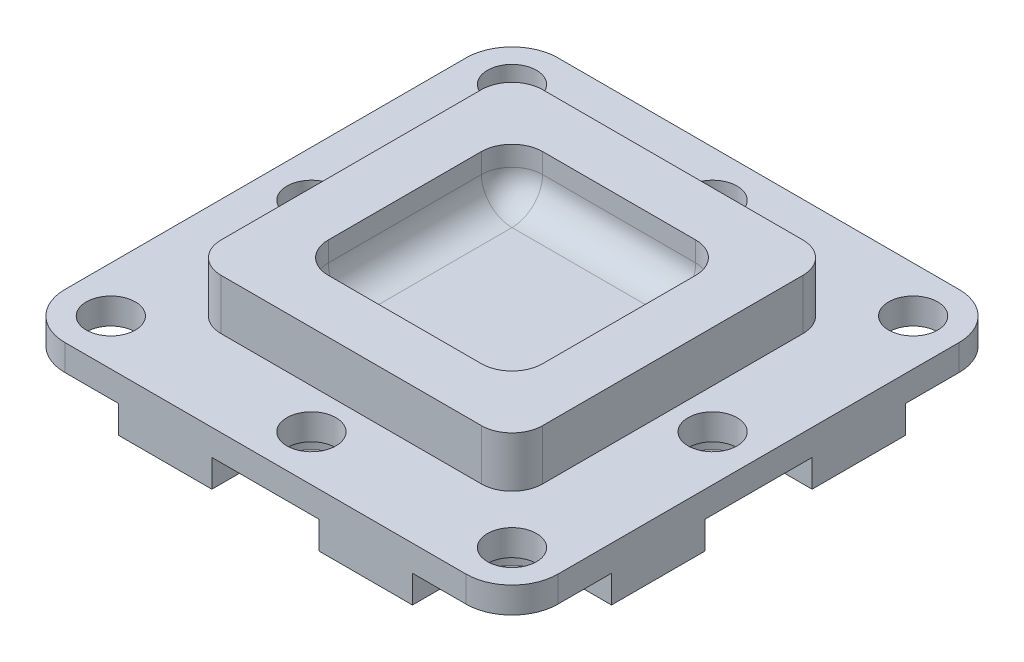
from build123d import *

# Parameters (mm, degrees)
SKETCH1_W           = 32.2
SKETCH1_H           = 32.2
BOSS_EXTRUDE1_DEPTH = 3.5
SKETCH2_W           = 21
SKETCH2_H           = 21
BOSS_EXTRUDE3_DEPTH = 3.3
FILLET1_R           = 3
FILLET2_R           = 2
SKETCH10_W          = 14
SKETCH10_H          = 14
CUT_EXTRUDE2_DEPTH  = 3.3
FILLET3_R           = 2
SKETCH9_R           = 1.6
CUT_EXTRUDE1_DEPTH  = 7
SKETCH11_R          = 1.6
CUT_EXTRUDE3_DEPTH  = 24.762575618
CUT_EXTRUDE5_DEPTH  = 1.8
CUT_EXTRUDE6_DEPTH  = 0.5


with BuildPart() as part:
    # Sketch1 → Boss-Extrude1 (new body)
    with BuildSketch(Plane(origin=(0, 0, 0), x_dir=(1, 0, 0), z_dir=(0, 1, 0))):
        Rectangle(SKETCH1_W, SKETCH1_H)
    extrude(amount=BOSS_EXTRUDE1_DEPTH)

    # Sketch2 → Boss-Extrude3 (add)
    with BuildSketch(Plane(origin=(0, 3.5, 0), x_dir=(1, 0, 0), z_dir=(0, 1, 0))):
        Rectangle(SKETCH2_W, SKETCH2_H)
    extrude(amount=BOSS_EXTRUDE3_DEPTH)

    # Fillet1
    fillet1_edges = [part.edges().sort_by_distance(p)[0] for p in [
        (16.1, 1.75, 16.1),
        (-16.1, 1.75, 16.1),
        (-16.1, 1.75, -16.1),
        (16.1, 1.75, -16.1),
    ]]
    fillet(fillet1_edges, radius=FILLET1_R)

    # Fillet2
    fillet2_edges = [part.edges().sort_by_distance(p)[0] for p in [
        (10.5, 5.15, 10.5),
        (10.5, 5.15, -10.5),
        (-10.5, 5.15, -10.5),
        (-10.5, 5.15, 10.5),
    ]]
    fillet(fillet2_edges, radius=FILLET2_R)

    # Sketch10 → Cut-Extrude2 (cut)
    with BuildSketch(Plane(origin=(0, 6.8, 0), x_dir=(1, 0, 0), z_dir=(0, 1, 0))):
        Rectangle(SKETCH10_W, SKETCH10_H)
    extrude(amount=-CUT_EXTRUDE2_DEPTH, mode=Mode.SUBTRACT)

    # Fillet3
    fillet3_edges = [part.edges().sort_by_distance(p)[0] for p in [
        (0, 3.5, -7),
        (-7, 5.15, -7),
        (-7, 3.5, 0),
        (-7, 5.15, 7),
        (0, 3.5, 7),
        (7, 5.15, 7),
        (7, 3.5, 0),
        (7, 5.15, -7),
    ]]
    fillet(fillet3_edges, radius=FILLET3_R)

    # Sketch9 → Cut-Extrude1 (cut)
    with BuildSketch(Plane(origin=(0, 3.5, 0), x_dir=(1, 0, 0), z_dir=(0, 1, 0))):
        with Locations(Location((0, 13.1, 0), (0, 0, 270))):
            Circle(SKETCH9_R)
        with Locations(Location((13.1, 0, 0), (0, 0, 270))):
            Circle(SKETCH9_R)
        with Locations(Location((0, -13.1, 0), (0, 0, 270))):
            Circle(SKETCH9_R)
        with Locations(Location((-13.1, 0, 0), (0, 0, 270))):
            Circle(SKETCH9_R)
    extrude(amount=-CUT_EXTRUDE1_DEPTH, mode=Mode.SUBTRACT)

    # Sketch11 → Cut-Extrude3 (cut, through all)
    with BuildSketch(Plane.XZ):
        with Locations(Location((-13.1, 13.1, 0), (0, 0, 270))):
            Circle(SKETCH11_R)
        with Locations(Location((13.1, 13.1, 0), (0, 0, 270))):
            Circle(SKETCH11_R)
        with Locations(Location((13.1, -13.1, 0), (0, 0, 270))):
            Circle(SKETCH11_R)
        with Locations(Location((-13.1, -13.1, 0), (0, 0, 270))):
            Circle(SKETCH11_R)
    extrude(amount=-CUT_EXTRUDE3_DEPTH, mode=Mode.SUBTRACT)

    # Sketch12 → Cut-Extrude5 (cut)
    with BuildSketch(Plane.XZ):
        with BuildLine():
            Line((-13.1, 9.6), (-16.1, 9.6))
            Line((-16.1, 9.6), (-16.1, 16.1))
            Line((-16.1, 16.1), (-9.6, 16.1))
            Line((-9.6, 16.1), (-9.6, 13.1))
            ThreePointArc((-9.6, 13.1), (-10.625126266, 10.625126266), (-13.1, 9.6))
        make_face()
        with BuildLine():
            Line((-3.5, 13.1), (-3.5, 16.1))
            Line((-3.5, 16.1), (3.5, 16.1))
            Line((3.5, 16.1), (3.5, 13.1))
            ThreePointArc((3.5, 13.1), (0, 9.6), (-3.5, 13.1))
        make_face()
        with BuildLine():
            Line((13.1, 3.5), (16.1, 3.5))
            Line((16.1, 3.5), (16.1, -3.5))
            Line((16.1, -3.5), (13.1, -3.5))
            ThreePointArc((13.1, -3.5), (9.6, 0), (13.1, 3.5))
        make_face()
        with BuildLine():
            Line((3.5, -13.1), (3.5, -16.1))
            Line((3.5, -16.1), (-3.5, -16.1))
            Line((-3.5, -16.1), (-3.5, -13.1))
            ThreePointArc((-3.5, -13.1), (0, -9.6), (3.5, -13.1))
        make_face()
        with BuildLine():
            Line((-13.1, -3.5), (-16.1, -3.5))
            Line((-16.1, -3.5), (-16.1, 3.5))
            Line((-16.1, 3.5), (-13.1, 3.5))
            ThreePointArc((-13.1, 3.5), (-9.6, 0), (-13.1, -3.5))
        make_face()
        with BuildLine():
            Line((9.6, 13.1), (9.6, 16.1))
            Line((9.6, 16.1), (16.1, 16.1))
            Line((16.1, 16.1), (16.1, 9.6))
            Line((16.1, 9.6), (13.1, 9.6))
            ThreePointArc((13.1, 9.6), (10.625126266, 10.625126266), (9.6, 13.1))
        make_face()
        with BuildLine():
            Line((13.1, -9.6), (16.1, -9.6))
            Line((16.1, -9.6), (16.1, -16.1))
            Line((16.1, -16.1), (9.6, -16.1))
            Line((9.6, -16.1), (9.6, -13.1))
            ThreePointArc((9.6, -13.1), (10.625126266, -10.625126266), (13.1, -9.6))
        make_face()
        with BuildLine():
            Line((-9.6, -13.1), (-9.6, -16.1))
            Line((-9.6, -16.1), (-16.1, -16.1))
            Line((-16.1, -16.1), (-16.1, -9.6))
            Line((-16.1, -9.6), (-13.1, -9.6))
            ThreePointArc((-13.1, -9.6), (-10.625126266, -10.625126266), (-9.6, -13.1))
        make_face()
    extrude(amount=-CUT_EXTRUDE5_DEPTH, mode=Mode.SUBTRACT)

    # Sketch13 → Cut-Extrude6 (cut)
    # profile 1 of 6: a face of its own
    with BuildSketch(Plane(origin=(0, 0, 0), x_dir=(-1, 0, 0), z_dir=(0, -1, 0))):
        with BuildLine():
            add(Edge.make_bspline(
                [(-3.374888958, -0.575719771), (-3.353910365, -0.592843), (-3.312166011, -0.626915741), (-3.245070547, -0.671708656), (-3.175802228, -0.712439804), (-3.127253594, -0.734927656), (-3.102973374, -0.746174317)],
                knots=[0, 0, 0, 0, 1.00866874, 2.00710438, 3.003309844, 4, 4, 4, 4], degree=3))
            Line((-3.102973374, -0.746174317), (-3.22756753, -1.021336654))
            add(Edge.make_bspline(
                [(-3.22756753, -1.021336654), (-3.252748596, -1.011665292), (-3.304075792, -0.991951912), (-3.351797169, -0.964635024), (-3.376106491, -0.950719771)],
                knots=[0, 0, 0, 0, 0.981197824, 2, 2, 2, 2], degree=3))
            add(Edge.make_bspline(
                [(-3.376106491, -0.950719771), (-3.378546656, -0.949103953), (-3.385523996, -0.944483728), (-3.398956827, -0.935063), (-3.4183981, -0.920800488), (-3.443942113, -0.901692247), (-3.47556492, -0.877879475), (-3.512829919, -0.848751255), (-3.556805929, -0.815703153), (-3.587979338, -0.791793214), (-3.60459675, -0.779047693)],
                knots=[0, 0, 0, 0, 0.245733965, 0.702644866, 1.377434016, 2.270258751, 3.381183773, 4.701231263, 6.241546137, 8, 8, 8, 8], degree=3))
            add(Edge.make_bspline(
                [(-3.60459675, -0.779047693), (-3.618300093, -0.786018401), (-3.64569084, -0.79995171), (-3.688570898, -0.817168408), (-3.732496042, -0.832426458), (-3.778079583, -0.844577823), (-3.825295009, -0.853789145), (-3.873909342, -0.860734788), (-3.923922732, -0.864891407), (-3.957673379, -0.865290731), (-3.97472662, -0.865492498)],
                knots=[0, 0, 0, 0, 0.96057198, 1.920026713, 2.885388124, 3.865852884, 4.865850518, 5.890708888, 6.934235263, 8, 8, 8, 8], degree=3))
            add(Edge.make_bspline(
                [(-3.97472662, -0.865492498), (-4.003595932, -0.864804682), (-4.060133704, -0.863457661), (-4.142609937, -0.850183912), (-4.221092935, -0.830389621), (-4.295117072, -0.800970455), (-4.365354173, -0.764293287), (-4.430511274, -0.718074343), (-4.491943721, -0.664589017), (-4.548617474, -0.602861591), (-4.60008491, -0.533317659), (-4.644143378, -0.455568933), (-4.682167346, -0.370891255), (-4.712228357, -0.278518544), (-4.736279231, -0.179214229), (-4.752840652, -0.072509427), (-4.763842385, 0.041473673), (-4.76481152, 0.120004689), (-4.765311036, 0.160481528)],
                knots=[0, 0, 0, 0, 0.947648696, 1.855878837, 2.737616271, 3.60168255, 4.466468547, 5.334434689, 6.219492212, 7.137875445, 8.081848884, 9.055322791, 10.067899029, 11.126141109, 12.241766859, 13.421002704, 14.670720672, 16, 16, 16, 16], degree=3))
            add(Edge.make_bspline(
                [(-4.765311036, 0.160481528), (-4.764807119, 0.200957844), (-4.763827769, 0.279622593), (-4.752843981, 0.393879364), (-4.736281731, 0.500845718), (-4.712368629, 0.600389017), (-4.68160542, 0.692557887), (-4.643953334, 0.777401308), (-4.599104008, 0.854749217), (-4.547422085, 0.924268421), (-4.490283797, 0.985933742), (-4.428615913, 1.039530788), (-4.362832018, 1.08505113), (-4.292531173, 1.122223639), (-4.217851179, 1.151077332), (-4.138946882, 1.171893923), (-4.055743644, 1.184206467), (-3.998848194, 1.185696361), (-3.969856491, 1.186455554)],
                knots=[0, 0, 0, 0, 1.325551311, 2.576177175, 3.756481842, 4.868978776, 5.925657186, 6.935393612, 7.904517475, 8.848479123, 9.767294862, 10.653212949, 11.519856, 12.382216669, 13.252116938, 14.136792688, 15.05058218, 16, 16, 16, 16], degree=3))
            add(Edge.make_bspline(
                [(-3.969856491, 1.186455554), (-3.941132787, 1.185709096), (-3.884904679, 1.184247866), (-3.802538998, 1.171784149), (-3.724398718, 1.151154272), (-3.650402027, 1.122222849), (-3.58085668, 1.084930623), (-3.515545363, 1.039532342), (-3.454292064, 0.985916571), (-3.397566798, 0.924249691), (-3.346252099, 0.854746102), (-3.302004123, 0.777379279), (-3.264194045, 0.69298461), (-3.233245276, 0.601144024), (-3.21017311, 0.501843612), (-3.193267001, 0.395388416), (-3.182400518, 0.281647971), (-3.181406805, 0.203256142), (-3.180895452, 0.162916593)],
                knots=[0, 0, 0, 0, 0.945533866, 1.850930545, 2.735974148, 3.602169806, 4.4612212, 5.328779171, 6.216017803, 7.136664272, 8.082964012, 9.054975088, 10.065981232, 11.124021059, 12.241357431, 13.419100612, 14.671898348, 16, 16, 16, 16], degree=3))
            add(Edge.make_bspline(
                [(-3.180895452, 0.162916593), (-3.181353071, 0.123935416), (-3.182234672, 0.048838527), (-3.191400425, -0.059574831), (-3.205609691, -0.159565044), (-3.226102879, -0.252090127), (-3.252426213, -0.338916065), (-3.286743221, -0.421129488), (-3.326473103, -0.500817974), (-3.358716895, -0.550700766), (-3.374888958, -0.575719771)],
                knots=[0, 0, 0, 0, 1.205362501, 2.322120058, 3.362359562, 4.326735612, 5.250511105, 6.164254531, 7.079271134, 8, 8, 8, 8], degree=3))
        make_face()
        with BuildLine():
            add(Edge.make_bspline(
                [(-3.648022075, -0.345606135), (-3.63545867, -0.330470406), (-3.610003545, -0.29980341), (-3.578547091, -0.247780512), (-3.552227592, -0.190881694), (-3.530161085, -0.129260367), (-3.513306182, -0.062509006), (-3.501280578, 0.009151018), (-3.493864143, 0.085785356), (-3.493019388, 0.138548524), (-3.492583763, 0.165757502)],
                knots=[0, 0, 0, 0, 0.863345217, 1.749252022, 2.661353163, 3.614576314, 4.620864843, 5.682111508, 6.804708329, 8, 8, 8, 8], degree=3))
            add(Edge.make_bspline(
                [(-3.492583763, 0.165757502), (-3.4929016, 0.193910779), (-3.493515278, 0.248269092), (-3.500232534, 0.32699693), (-3.510541327, 0.40009642), (-3.524996586, 0.467566517), (-3.543575863, 0.52946165), (-3.566713372, 0.585591085), (-3.593785388, 0.636476595), (-3.625732819, 0.681238774), (-3.660707181, 0.720527178), (-3.697779743, 0.75521533), (-3.737738562, 0.783977599), (-3.779941228, 0.807970143), (-3.824741052, 0.826192979), (-3.87189054, 0.839091521), (-3.921247493, 0.847688952), (-3.955073739, 0.848420733), (-3.972291555, 0.848793216)],
                knots=[0, 0, 0, 0, 1.436691862, 2.773962903, 4.029794328, 5.202699272, 6.292689818, 7.323690881, 8.296929065, 9.22807889, 10.123225381, 10.978380823, 11.814021444, 12.630264847, 13.45093584, 14.275201199, 15.1220643, 16, 16, 16, 16], degree=3))
            add(Edge.make_bspline(
                [(-3.972291555, 0.848793216), (-3.989510866, 0.848425707), (-4.023340048, 0.847703696), (-4.072804565, 0.83901297), (-4.12003303, 0.826355737), (-4.164919664, 0.807818459), (-4.207092095, 0.783658806), (-4.247231154, 0.754688854), (-4.284680927, 0.72026414), (-4.319672166, 0.680828005), (-4.351536357, 0.635961862), (-4.379204186, 0.58531599), (-4.402161116, 0.528851976), (-4.421286771, 0.466956453), (-4.435586563, 0.399402758), (-4.446047458, 0.326331405), (-4.452653493, 0.247724127), (-4.453293066, 0.193368495), (-4.453622724, 0.165351657)],
                knots=[0, 0, 0, 0, 0.876848581, 1.722663039, 2.552553991, 3.365829814, 4.19045996, 5.025065834, 5.884242765, 6.778280825, 7.708277638, 8.683608006, 9.713332414, 10.810589915, 11.982042488, 13.229493461, 14.571981773, 16, 16, 16, 16], degree=3))
            add(Edge.make_bspline(
                [(-4.453622724, 0.165351657), (-4.453249878, 0.136797574), (-4.452529776, 0.081649223), (-4.446545806, 0.00165222), (-4.435930516, -0.072442452), (-4.422104171, -0.141093249), (-4.403388196, -0.203807382), (-4.380761439, -0.260961877), (-4.353977952, -0.312480964), (-4.323085195, -0.35817187), (-4.288763382, -0.397776427), (-4.252964471, -0.432826788), (-4.214752501, -0.462267066), (-4.174175026, -0.485778475), (-4.13201531, -0.504890929), (-4.087682979, -0.518249047), (-4.041155566, -0.526079702), (-4.009523827, -0.527239039), (-3.993395452, -0.527830161)],
                knots=[0, 0, 0, 0, 1.469371971, 2.83789331, 4.124714215, 5.319424688, 6.438363687, 7.488110163, 8.478364614, 9.42066665, 10.319263503, 11.171036346, 11.995366908, 12.794166486, 13.579503905, 14.372365502, 15.170102543, 16, 16, 16, 16], degree=3))
            add(Edge.make_bspline(
                [(-3.993395452, -0.527830161), (-3.981329556, -0.52758852), (-3.957195486, -0.527105192), (-3.921762632, -0.521040296), (-3.886995244, -0.512270787), (-3.864929209, -0.503463317), (-3.853785062, -0.499015226)],
                knots=[0, 0, 0, 0, 1.00771838, 2.015627189, 2.9978198, 4, 4, 4, 4], degree=3))
            add(Edge.make_bspline(
                [(-3.853785062, -0.499015226), (-3.871340209, -0.485657725), (-3.905474244, -0.459685547), (-3.958445791, -0.425418298), (-4.01070884, -0.395557034), (-4.046562527, -0.379429399), (-4.064012335, -0.371580161)],
                knots=[0, 0, 0, 0, 1.073447796, 2.087200056, 3.069049988, 4, 4, 4, 4], degree=3))
            Line((-4.064012335, -0.371580161), (-3.968638958, -0.138219771))
            add(Edge.make_bspline(
                [(-3.968638958, -0.138219771), (-3.940635066, -0.1506716), (-3.883966153, -0.175869227), (-3.802813042, -0.224211253), (-3.72301942, -0.280077816), (-3.673344133, -0.323481193), (-3.648022075, -0.345606135)],
                knots=[0, 0, 0, 0, 0.957793148, 1.938198301, 2.94899324, 4, 4, 4, 4], degree=3))
        make_face(mode=Mode.SUBTRACT)
    # profile 2 of 6: a face of its own
    with BuildSketch(Plane(origin=(0, 0, 0), x_dir=(-1, 0, 0), z_dir=(0, -1, 0))):
        with BuildLine():
            Line((-1.856220127, -0.112245745), (-1.544531815, -0.242115875))
            add(Edge.make_bspline(
                [(-1.544531815, -0.242115875), (-1.550969068, -0.268316149), (-1.563512372, -0.319368677), (-1.587242575, -0.392337089), (-1.613354952, -0.460040661), (-1.643228978, -0.522100432), (-1.675840425, -0.579060873), (-1.712065109, -0.630361473), (-1.751221494, -0.676264894), (-1.793532293, -0.716663879), (-1.838928886, -0.751423977), (-1.886136655, -0.782398753), (-1.936374643, -0.807791472), (-1.988939383, -0.829231716), (-2.04424413, -0.845168974), (-2.10186869, -0.85716242), (-2.162060402, -0.864025629), (-2.203064796, -0.864998041), (-2.223914932, -0.865492498)],
                knots=[0, 0, 0, 0, 1.282586353, 2.499182829, 3.646034602, 4.730797578, 5.771318175, 6.763713287, 7.712684321, 8.6363956, 9.539720391, 10.428356747, 11.317388874, 12.212151588, 13.124116906, 14.050177375, 15.008543639, 16, 16, 16, 16], degree=3))
            add(Edge.make_bspline(
                [(-2.223914932, -0.865492498), (-2.250075506, -0.864904344), (-2.301323451, -0.863752165), (-2.376104051, -0.851354996), (-2.447264235, -0.832519657), (-2.51467573, -0.805471993), (-2.578418473, -0.77089932), (-2.637819078, -0.728075985), (-2.694263606, -0.67859623), (-2.727082211, -0.640016603), (-2.743801296, -0.620362628)],
                knots=[0, 0, 0, 0, 1.053414494, 2.063614103, 3.046293227, 4.01520277, 4.983805463, 5.961130836, 6.961320097, 8, 8, 8, 8], degree=3))
            add(Edge.make_bspline(
                [(-2.743801296, -0.620362628), (-2.762178929, -0.596097329), (-2.79920237, -0.547212642), (-2.845683245, -0.466601878), (-2.885216121, -0.379999161), (-2.91757183, -0.287325996), (-2.9427914, -0.188479712), (-2.960423154, -0.083413185), (-2.97101156, 0.027822765), (-2.972395445, 0.104045521), (-2.973103244, 0.143030229)],
                knots=[0, 0, 0, 0, 0.898140554, 1.809387162, 2.740718204, 3.705966939, 4.703925369, 5.74945803, 6.848943185, 8, 8, 8, 8], degree=3))
            add(Edge.make_bspline(
                [(-2.973103244, 0.143030229), (-2.972456619, 0.1841841), (-2.971197101, 0.264344935), (-2.959857055, 0.381051491), (-2.942569641, 0.491077997), (-2.916794823, 0.594015502), (-2.884506187, 0.690455082), (-2.84461367, 0.779795352), (-2.798294454, 0.862970675), (-2.760503268, 0.912645784), (-2.741772075, 0.937267242)],
                knots=[0, 0, 0, 0, 1.171098873, 2.281104103, 3.334483992, 4.338438261, 5.297974877, 6.225356982, 7.120398547, 8, 8, 8, 8], degree=3))
            add(Edge.make_bspline(
                [(-2.741772075, 0.937267242), (-2.724765077, 0.957169808), (-2.691247931, 0.996393496), (-2.633959157, 1.047185417), (-2.572413026, 1.090360359), (-2.50663181, 1.125709669), (-2.436321162, 1.153203208), (-2.361825198, 1.172603078), (-2.282845652, 1.184049779), (-2.228823028, 1.185641371), (-2.201187659, 1.186455554)],
                knots=[0, 0, 0, 0, 1.017460211, 2.005195831, 2.96880208, 3.936538458, 4.903086366, 5.898753713, 6.925103759, 8, 8, 8, 8], degree=3))
            add(Edge.make_bspline(
                [(-2.201187659, 1.186455554), (-2.178571846, 1.185914214), (-2.134121527, 1.184850237), (-2.068943194, 1.176344324), (-2.006844806, 1.161387865), (-1.947220195, 1.141769657), (-1.890592474, 1.115520698), (-1.836797903, 1.083669118), (-1.785624933, 1.046319634), (-1.754608187, 1.017283896), (-1.738931166, 1.002608151)],
                knots=[0, 0, 0, 0, 1.062174293, 2.087653736, 3.080296642, 4.058948008, 5.03139012, 6.005719887, 6.992016441, 8, 8, 8, 8], degree=3))
            add(Edge.make_bspline(
                [(-1.738931166, 1.002608151), (-1.728031085, 0.99129729), (-1.705819787, 0.968248936), (-1.675912224, 0.929425422), (-1.648223009, 0.886668846), (-1.623248582, 0.839796743), (-1.60003065, 0.789267233), (-1.578918188, 0.734821308), (-1.560345104, 0.676335102), (-1.549884343, 0.635778732), (-1.544531815, 0.615026982)],
                knots=[0, 0, 0, 0, 0.858002413, 1.748367619, 2.673305357, 3.63929672, 4.648357542, 5.711115493, 6.828831091, 8, 8, 8, 8], degree=3))
            Line((-1.544531815, 0.615026982), (-1.856220127, 0.511130878))
            add(Edge.make_bspline(
                [(-1.856220127, 0.511130878), (-1.859149045, 0.524433331), (-1.864848234, 0.550317695), (-1.876290755, 0.587672355), (-1.890221567, 0.62236741), (-1.905378473, 0.655235765), (-1.923629911, 0.685140554), (-1.94272149, 0.713510646), (-1.965108154, 0.738645448), (-1.988759044, 0.761865695), (-2.014508396, 0.781931837), (-2.040865171, 0.800078532), (-2.068615167, 0.815166179), (-2.097642632, 0.827300439), (-2.127603759, 0.837120724), (-2.158721806, 0.84402659), (-2.190925557, 0.848208547), (-2.212809093, 0.848596388), (-2.223914932, 0.848793216)],
                knots=[0, 0, 0, 0, 1.200071046, 2.335138942, 3.437621639, 4.493482591, 5.51985659, 6.521917265, 7.50210956, 8.480124453, 9.438987346, 10.374745328, 11.297656865, 12.216555725, 13.143999084, 14.072438006, 15.021767148, 16, 16, 16, 16], degree=3))
            add(Edge.make_bspline(
                [(-2.223914932, 0.848793216), (-2.239632451, 0.848327209), (-2.270566135, 0.84741006), (-2.315886647, 0.840113036), (-2.358766007, 0.827206635), (-2.399849781, 0.810263074), (-2.438447607, 0.787689203), (-2.474989169, 0.760351929), (-2.508491905, 0.727425098), (-2.540600742, 0.690388065), (-2.569696782, 0.647476007), (-2.594401306, 0.597881079), (-2.614778054, 0.541780335), (-2.63233022, 0.479576125), (-2.645462468, 0.410859761), (-2.654575844, 0.335737656), (-2.660263617, 0.254318749), (-2.661022335, 0.197828957), (-2.661414932, 0.168598411)],
                knots=[0, 0, 0, 0, 0.827686898, 1.628972485, 2.409099021, 3.181967192, 3.964173723, 4.757978677, 5.579415306, 6.433460257, 7.33665582, 8.302235029, 9.343905073, 10.476376866, 11.703364719, 13.024698166, 14.460435141, 16, 16, 16, 16], degree=3))
            add(Edge.make_bspline(
                [(-2.661414932, 0.168598411), (-2.660971317, 0.138289785), (-2.66011705, 0.079924551), (-2.655137356, -0.004374411), (-2.645672141, -0.08182585), (-2.633555945, -0.152734307), (-2.616976068, -0.21668532), (-2.596720545, -0.273718054), (-2.573389405, -0.324389302), (-2.545557858, -0.368034247), (-2.514719951, -0.405712828), (-2.481933618, -0.438426046), (-2.44656588, -0.465753388), (-2.409562917, -0.488913153), (-2.369908848, -0.506463008), (-2.328072799, -0.518403537), (-2.284302883, -0.526662221), (-2.254257572, -0.527435635), (-2.238931166, -0.527830161)],
                knots=[0, 0, 0, 0, 1.588381619, 3.058741945, 4.422565575, 5.675514383, 6.825848758, 7.879737597, 8.8437938, 9.742560847, 10.584031071, 11.391113559, 12.163968987, 12.921455088, 13.673648094, 14.427376256, 15.197789283, 16, 16, 16, 16], degree=3))
            add(Edge.make_bspline(
                [(-2.238931166, -0.527830161), (-2.22769054, -0.527482032), (-2.205392289, -0.526791442), (-2.172580219, -0.522393965), (-2.140917122, -0.514531359), (-2.110398727, -0.503622884), (-2.081155103, -0.489230545), (-2.05288621, -0.472179803), (-2.026163115, -0.451684625), (-2.000292418, -0.428413358), (-1.975891682, -0.401647289), (-1.953591275, -0.370873848), (-1.932871676, -0.336643036), (-1.913858145, -0.298742557), (-1.89642942, -0.257416007), (-1.881062407, -0.212346252), (-1.867156688, -0.163758305), (-1.859935865, -0.129747333), (-1.856220127, -0.112245745)],
                knots=[0, 0, 0, 0, 0.874040642, 1.73385169, 2.568061146, 3.406503852, 4.248567505, 5.09821747, 5.96915136, 6.862782357, 7.800986125, 8.779254107, 9.812897901, 10.908933612, 12.073249979, 13.297367906, 14.609261928, 16, 16, 16, 16], degree=3))
        make_face()
    # profile 3 of 6: a face of its own
    with BuildSketch(Plane(origin=(0, 0, 0), x_dir=(-1, 0, 0), z_dir=(0, -1, 0))):
        with BuildLine():
            Line((-1.232843504, 1.160481528), (-0.627729867, 1.160481528))
            add(Edge.make_bspline(
                [(-0.627729867, 1.160481528), (-0.609193896, 1.160333232), (-0.573322477, 1.160046246), (-0.521200186, 1.157631355), (-0.472629531, 1.153475475), (-0.42746341, 1.148531534), (-0.386007263, 1.141216161), (-0.348150681, 1.132135344), (-0.313479124, 1.122410269), (-0.272038801, 1.105797413), (-0.22326051, 1.079991097), (-0.167675376, 1.041274774), (-0.115172983, 0.992932701), (-0.06476549, 0.936534685), (-0.018014051, 0.871023065), (0.023440397, 0.796274731), (0.058851853, 0.712283837), (0.084344217, 0.636472605), (0.101301339, 0.570910403), (0.112633025, 0.518099064), (0.122350996, 0.462319379), (0.130474918, 0.403586368), (0.136569156, 0.341849706), (0.140285142, 0.277259824), (0.143495437, 0.209755191), (0.143683611, 0.163732601), (0.143779873, 0.14018932)],
                knots=[0, 0, 0, 0, 0.908166205, 1.757513041, 2.555659328, 3.296423069, 3.982950475, 4.616390098, 5.203654025, 5.745226596, 6.800700335, 7.90028988, 9.054632423, 10.289284126, 11.600705304, 12.989365954, 14.46805874, 16.061045217, 16.903458281, 17.784890152, 18.706788133, 19.676982865, 20.689369861, 21.745342977, 22.846609335, 24, 24, 24, 24], degree=3))
            add(Edge.make_bspline(
                [(0.143779873, 0.14018932), (0.143117201, 0.098363386), (0.141834446, 0.017399717), (0.130897227, -0.099962906), (0.112377791, -0.208907366), (0.086933798, -0.309156927), (0.055800449, -0.399989515), (0.02046317, -0.481132263), (-0.018076113, -0.552909576), (-0.062063919, -0.614502627), (-0.110154584, -0.667612905), (-0.16258977, -0.713505367), (-0.219611241, -0.752829786), (-0.282343696, -0.784868683), (-0.351875403, -0.810179019), (-0.430089811, -0.82701435), (-0.517185423, -0.837596139), (-0.578318375, -0.838858508), (-0.610278568, -0.839518472)],
                knots=[0, 0, 0, 0, 1.423656938, 2.755813916, 4.008096835, 5.182036843, 6.272883028, 7.273103345, 8.192341091, 9.040888725, 9.842934101, 10.626222939, 11.407993985, 12.194794984, 13.017916928, 13.919554796, 14.912347131, 16, 16, 16, 16], degree=3))
            Line((-0.610278568, -0.839518472), (-1.232843504, -0.839518472))
            Line((-1.232843504, -0.839518472), (-1.232843504, 1.160481528))
        make_face()
        with BuildLine():
            Line((-0.921155192, 0.82281919), (-0.921155192, -0.501856135))
            Line((-0.921155192, -0.501856135), (-0.654921426, -0.501856135))
            add(Edge.make_bspline(
                [(-0.654921426, -0.501856135), (-0.64111891, -0.501846759), (-0.61458553, -0.501828737), (-0.576186757, -0.499779341), (-0.54064993, -0.498374037), (-0.508241348, -0.494277785), (-0.478646602, -0.490535467), (-0.452106518, -0.485254101), (-0.428377642, -0.479207085), (-0.400968662, -0.470210046), (-0.370415809, -0.455553326), (-0.336870615, -0.434966968), (-0.306854444, -0.410363463), (-0.279984127, -0.381014428), (-0.256067456, -0.345074112), (-0.234633594, -0.301136055), (-0.216036682, -0.248446566), (-0.198858215, -0.187110365), (-0.184658843, -0.116082239), (-0.174946057, -0.034684065), (-0.168913449, 0.057035121), (-0.168254731, 0.121645351), (-0.167908439, 0.155611398)],
                knots=[0, 0, 0, 0, 0.858490732, 1.650326785, 2.392144379, 3.069685377, 3.68146636, 4.247606386, 4.751804594, 5.204247195, 6.040121741, 6.852838077, 7.648110604, 8.446361275, 9.319374262, 10.324322919, 11.479823707, 12.790802805, 14.284548749, 15.980882315, 17.887121902, 20, 20, 20, 20], degree=3))
            add(Edge.make_bspline(
                [(-0.167908439, 0.155611398), (-0.167943889, 0.173605481), (-0.168013206, 0.20878992), (-0.169779295, 0.259931527), (-0.172083096, 0.308252003), (-0.175639322, 0.353470951), (-0.180647444, 0.395938552), (-0.186170303, 0.435344131), (-0.192632103, 0.471937284), (-0.202701044, 0.515781108), (-0.217668973, 0.565956726), (-0.241441942, 0.620092436), (-0.269306811, 0.667675122), (-0.302098982, 0.708345419), (-0.339025697, 0.742352255), (-0.379584186, 0.770376859), (-0.424230841, 0.791918198), (-0.456157936, 0.800583325), (-0.472291555, 0.804962047)],
                knots=[0, 0, 0, 0, 1.108457535, 2.167404399, 3.152090602, 4.088510939, 4.961000864, 5.786027902, 6.539647428, 7.24926465, 8.556831451, 9.758435817, 10.883283124, 11.944064911, 12.964396832, 13.965348377, 14.971835819, 16, 16, 16, 16], degree=3))
            add(Edge.make_bspline(
                [(-0.472291555, 0.804962047), (-0.479178232, 0.806387099), (-0.494366611, 0.809530012), (-0.519589554, 0.812957085), (-0.549073256, 0.816288862), (-0.582936028, 0.81849305), (-0.621077933, 0.820669821), (-0.663711252, 0.821671138), (-0.710653925, 0.822533009), (-0.743394906, 0.822721208), (-0.760440906, 0.82281919)],
                knots=[0, 0, 0, 0, 0.583558982, 1.287023661, 2.111612924, 3.046011902, 4.102984757, 5.282460342, 6.58516209, 8, 8, 8, 8], degree=3))
            Line((-0.760440906, 0.82281919), (-0.921155192, 0.82281919))
        make_face(mode=Mode.SUBTRACT)
    # profile 4 of 6: a face of its own
    with BuildSketch(Plane(origin=(0, 0, 0), x_dir=(-1, 0, 0), z_dir=(0, -1, 0))):
        with BuildLine():
            Line((1.078844808, 1.160481528), (1.75092273, 1.160481528))
            add(Edge.make_bspline(
                [(1.75092273, 1.160481528), (1.772974013, 1.160283618), (1.815462829, 1.159902283), (1.876661679, 1.158187298), (1.932681243, 1.15398998), (1.983561762, 1.148708461), (2.029467497, 1.142680952), (2.070155857, 1.133901853), (2.105995341, 1.124581994), (2.146851167, 1.109284047), (2.192968865, 1.084720798), (2.242513572, 1.045647637), (2.288126101, 0.998016059), (2.327846799, 0.941614043), (2.361776707, 0.879082211), (2.386215912, 0.811282273), (2.400776463, 0.739158358), (2.402592435, 0.689770174), (2.403520133, 0.664539969)],
                knots=[0, 0, 0, 0, 1.124473672, 2.166656478, 3.121089245, 3.988001344, 4.77526076, 5.480116183, 6.109319004, 6.661554265, 7.701543192, 8.758483104, 9.865986798, 11.052779462, 12.265628083, 13.483214642, 14.714287386, 16, 16, 16, 16], degree=3))
            add(Edge.make_bspline(
                [(2.403520133, 0.664539969), (2.40269233, 0.641363601), (2.401065259, 0.595809792), (2.389658505, 0.529172065), (2.369957089, 0.466066603), (2.34290739, 0.407254623), (2.309898618, 0.353668683), (2.271441491, 0.307110977), (2.228846104, 0.267144456), (2.196368991, 0.247100026), (2.180305847, 0.237186073)],
                knots=[0, 0, 0, 0, 1.102195328, 2.166396157, 3.204342149, 4.237991037, 5.237902837, 6.188656202, 7.104111395, 8, 8, 8, 8], degree=3))
            add(Edge.make_bspline(
                [(2.180305847, 0.237186073), (2.200976603, 0.227586812), (2.242127531, 0.208476794), (2.297212988, 0.167564596), (2.344161884, 0.116521963), (2.384537667, 0.057480678), (2.416660865, -0.009830997), (2.439163463, -0.084692935), (2.453235044, -0.166235095), (2.454708095, -0.222981162), (2.455468185, -0.252261979)],
                knots=[0, 0, 0, 0, 0.914365049, 1.820299747, 2.735925076, 3.690630122, 4.685376883, 5.720815912, 6.823947219, 8, 8, 8, 8], degree=3))
            add(Edge.make_bspline(
                [(2.455468185, -0.252261979), (2.455156907, -0.270398575), (2.454547117, -0.3059279), (2.449744097, -0.358187382), (2.440950663, -0.408123284), (2.430010417, -0.45619484), (2.414596603, -0.501726489), (2.396961558, -0.545508088), (2.37527984, -0.586961466), (2.350583929, -0.625984292), (2.324163218, -0.662338398), (2.295833437, -0.69495131), (2.266878997, -0.724380371), (2.236062175, -0.749620394), (2.204438463, -0.771710346), (2.171492321, -0.790148649), (2.137085824, -0.804464327), (2.113414041, -0.811328255), (2.101572081, -0.814761979)],
                knots=[0, 0, 0, 0, 1.22020471, 2.390363083, 3.526102761, 4.629955915, 5.703561803, 6.756598922, 7.802848293, 8.845806378, 9.861642828, 10.823224211, 11.750015592, 12.6357154, 13.499202288, 14.342595175, 15.170872714, 16, 16, 16, 16], degree=3))
            add(Edge.make_bspline(
                [(2.101572081, -0.814761979), (2.091848725, -0.816748514), (2.069808342, -0.821251486), (2.032424956, -0.826407255), (1.986883585, -0.830033758), (1.933198182, -0.833981518), (1.871057994, -0.835961819), (1.800719498, -0.838162867), (1.722111246, -0.83930092), (1.667048472, -0.839443505), (1.638098055, -0.839518472)],
                knots=[0, 0, 0, 0, 0.512375785, 1.161426047, 1.946914314, 2.871141027, 3.940743941, 5.156722563, 6.50508681, 8, 8, 8, 8], degree=3))
            Line((1.638098055, -0.839518472), (1.078844808, -0.839518472))
            Line((1.078844808, -0.839518472), (1.078844808, 1.160481528))
        make_face()
        with BuildLine():
            Line((1.39053312, 0.82281919), (1.39053312, 0.381260748))
            Line((1.39053312, 0.381260748), (1.629169483, 0.381260748))
            add(Edge.make_bspline(
                [(1.629169483, 0.381260748), (1.646215208, 0.381214943), (1.678683849, 0.381127693), (1.724812615, 0.381712132), (1.765809237, 0.381891506), (1.801516802, 0.38289542), (1.832106063, 0.38346625), (1.857524981, 0.384861846), (1.877991258, 0.385791627), (1.889861014, 0.387161479), (1.894997406, 0.387754255)],
                knots=[0, 0, 0, 0, 1.537921726, 2.929428249, 4.162267198, 5.236648627, 6.152403654, 6.922235861, 7.533619789, 8, 8, 8, 8], degree=3))
            add(Edge.make_bspline(
                [(1.894997406, 0.387754255), (1.909708412, 0.39044262), (1.937907463, 0.39559586), (1.97733324, 0.409883487), (2.011311056, 0.429989553), (2.040616994, 0.455012867), (2.063341558, 0.485967645), (2.080516826, 0.521614974), (2.090146144, 0.562582842), (2.091253614, 0.591438691), (2.091831821, 0.606504255)],
                knots=[0, 0, 0, 0, 1.100193615, 2.108925541, 3.069258182, 3.994366649, 4.926956476, 5.876216083, 6.891177988, 8, 8, 8, 8], degree=3))
            add(Edge.make_bspline(
                [(2.091831821, 0.606504255), (2.09127238, 0.620070072), (2.090205059, 0.645951391), (2.082508408, 0.682946184), (2.069079768, 0.715884869), (2.050190492, 0.744331331), (2.027838408, 0.7683167), (2.002976327, 0.787706624), (1.975571482, 0.801835434), (1.950007524, 0.809459678), (1.925280149, 0.813713427), (1.89960444, 0.815648475), (1.867039641, 0.81843411), (1.827218023, 0.819551723), (1.780295644, 0.8215576), (1.726299069, 0.821916426), (1.665293838, 0.823089316), (1.62227097, 0.822912564), (1.59954286, 0.82281919)],
                knots=[0, 0, 0, 0, 1.052351386, 2.007711197, 2.916182618, 3.795496935, 4.642249233, 5.450649971, 6.230038409, 7.020378978, 7.510527392, 8.174883014, 9.017067762, 10.046711282, 11.265182827, 12.661551488, 14.236365296, 16, 16, 16, 16], degree=3))
            Line((1.59954286, 0.82281919), (1.39053312, 0.82281919))
        make_face(mode=Mode.SUBTRACT)
        with BuildLine():
            Line((1.39053312, 0.043598411), (1.39053312, -0.501856135))
            Line((1.39053312, -0.501856135), (1.720078574, -0.501856135))
            add(Edge.make_bspline(
                [(1.720078574, -0.501856135), (1.737394588, -0.501743918), (1.770405092, -0.501529993), (1.817359712, -0.500868016), (1.859441887, -0.49923693), (1.896675965, -0.496958105), (1.929129347, -0.493590977), (1.956694935, -0.490289481), (1.979283874, -0.485709722), (2.003143336, -0.479578398), (2.028713734, -0.467647691), (2.05614989, -0.44885101), (2.080942334, -0.424577499), (2.103043544, -0.39562052), (2.121630965, -0.361708321), (2.134246868, -0.32303502), (2.14279777, -0.280368177), (2.143443498, -0.250414339), (2.143779873, -0.23481068)],
                knots=[0, 0, 0, 0, 1.422074328, 2.710981391, 3.856134465, 4.880390511, 5.773592636, 6.5356346, 7.158764273, 7.665440749, 8.555459036, 9.45835037, 10.38545437, 11.392024878, 12.440928025, 13.544085548, 14.72065637, 16, 16, 16, 16], degree=3))
            add(Edge.make_bspline(
                [(2.143779873, -0.23481068), (2.143232402, -0.218816324), (2.142180784, -0.188093325), (2.134243772, -0.144044448), (2.119872026, -0.104641001), (2.100249642, -0.069662016), (2.075844633, -0.039731689), (2.047774463, -0.014313967), (2.01577386, 0.005720001), (1.985708471, 0.018067267), (1.957996158, 0.025677279), (1.932134313, 0.030102023), (1.901611887, 0.034871534), (1.866199277, 0.03762737), (1.826051622, 0.040812845), (1.780957301, 0.041997997), (1.731045564, 0.043447371), (1.696135386, 0.043546531), (1.677870782, 0.043598411)],
                knots=[0, 0, 0, 0, 1.220775758, 2.344945564, 3.400211975, 4.408337778, 5.392209119, 6.335627291, 7.286926182, 8.259293687, 8.805475582, 9.477947255, 10.260788822, 11.163063353, 12.188028698, 13.335114355, 14.605762531, 16, 16, 16, 16], degree=3))
            Line((1.677870782, 0.043598411), (1.39053312, 0.043598411))
        make_face(mode=Mode.SUBTRACT)
    # profile 5 of 6: a face of its own
    with BuildSketch(Plane(origin=(0, 0, 0), x_dir=(-1, 0, 0), z_dir=(0, -1, 0))):
        with BuildLine():
            add(Edge.make_bspline(
                [(2.637286367, -0.091953537), (2.638254398, -0.057391617), (2.640159245, 0.010617659), (2.656538468, 0.109955116), (2.682295765, 0.204773639), (2.713385036, 0.279267098), (2.742532585, 0.335534784), (2.766052952, 0.375023232), (2.791372515, 0.411680728), (2.817919599, 0.445707901), (2.846375612, 0.476932204), (2.876046053, 0.505595595), (2.907707386, 0.531475484), (2.951787624, 0.562042319), (3.010421533, 0.594008035), (3.085493946, 0.621352047), (3.164809687, 0.63822652), (3.219182679, 0.640065018), (3.246864289, 0.641001008)],
                knots=[0, 0, 0, 0, 1.556681502, 3.063162581, 4.524556931, 5.976049118, 6.690484325, 7.379521108, 8.045822696, 8.697116328, 9.322943537, 9.94817653, 10.554730816, 11.163578782, 12.36395075, 13.552075371, 14.75374718, 16, 16, 16, 16], degree=3))
            add(Edge.make_bspline(
                [(3.246864289, 0.641001008), (3.270030644, 0.640251534), (3.315373175, 0.63878462), (3.381524548, 0.628711794), (3.443721609, 0.611038815), (3.502307935, 0.586805172), (3.55650049, 0.554572827), (3.607429017, 0.516342144), (3.653800429, 0.4702836), (3.695926693, 0.418138436), (3.733813156, 0.361476796), (3.767143613, 0.301918732), (3.795071753, 0.239909641), (3.818733837, 0.175935476), (3.835706934, 0.109030075), (3.848902765, 0.04009711), (3.856791888, -0.031299109), (3.857637021, -0.079623551), (3.858065587, -0.104128862)],
                knots=[0, 0, 0, 0, 1.032054068, 2.019995973, 2.972061934, 3.906723031, 4.836005299, 5.773828533, 6.737027708, 7.73951492, 8.755857002, 9.770356733, 10.776442903, 11.783124641, 12.804973846, 13.847568463, 14.908502576, 16, 16, 16, 16], degree=3))
            add(Edge.make_bspline(
                [(3.858065587, -0.104128862), (3.857876476, -0.122400787), (3.857501973, -0.158585366), (3.853156004, -0.212202956), (3.846912776, -0.264539243), (3.837432515, -0.31560673), (3.825399641, -0.365209104), (3.810516359, -0.413492242), (3.79377061, -0.460553243), (3.773708858, -0.505773928), (3.752112217, -0.549192186), (3.727961312, -0.589590462), (3.702988779, -0.627762676), (3.675487268, -0.662471812), (3.647256307, -0.695326737), (3.616685056, -0.724878453), (3.58458371, -0.751805828), (3.539957546, -0.783432386), (3.481303264, -0.816219127), (3.406690524, -0.844601688), (3.328723616, -0.862297698), (3.275365277, -0.864422297), (3.248487665, -0.865492498)],
                knots=[0, 0, 0, 0, 1.007877983, 1.995938637, 2.966162127, 3.914814336, 4.859789072, 5.780608151, 6.70142723, 7.613889557, 8.508470822, 9.375089484, 10.209347433, 11.023051667, 11.81647726, 12.597661281, 13.366010139, 14.126084987, 15.612979557, 17.05878539, 18.518454158, 20, 20, 20, 20], degree=3))
            add(Edge.make_bspline(
                [(3.248487665, -0.865492498), (3.226945236, -0.864853777), (3.184600668, -0.863598283), (3.122498712, -0.854132534), (3.063333263, -0.838218102), (3.006956804, -0.816208975), (2.953323739, -0.787904111), (2.902364998, -0.75340005), (2.854826821, -0.711764425), (2.80976431, -0.665053117), (2.768987186, -0.612101464), (2.733857087, -0.553383805), (2.703433894, -0.489638939), (2.679397234, -0.420258864), (2.660205366, -0.345764829), (2.647127862, -0.265758595), (2.638895283, -0.180600215), (2.637831807, -0.122005762), (2.637286367, -0.091953537)],
                knots=[0, 0, 0, 0, 0.932512926, 1.832980627, 2.712496059, 3.580506363, 4.447765331, 5.333190401, 6.238540988, 7.178967574, 8.139661075, 9.125124005, 10.136480502, 11.192447616, 12.299149515, 13.463368684, 14.698999463, 16, 16, 16, 16], degree=3))
        make_face()
        with BuildLine():
            add(Edge.make_bspline(
                [(2.948974678, -0.112245745), (2.949117947, -0.129843755), (2.949396176, -0.164019401), (2.95412823, -0.21360529), (2.960970193, -0.259942361), (2.969878663, -0.303147157), (2.982860155, -0.342741876), (2.997505862, -0.379383165), (3.015544034, -0.412570023), (3.03618485, -0.442180489), (3.059054433, -0.468178707), (3.083060758, -0.490858814), (3.107727634, -0.510907234), (3.134423251, -0.526097069), (3.16181786, -0.538540773), (3.1902727, -0.54747181), (3.219996636, -0.553024445), (3.240210713, -0.553540881), (3.250516886, -0.553804187)],
                knots=[0, 0, 0, 0, 1.413435947, 2.744917549, 3.997764295, 5.176762478, 6.28365779, 7.341374166, 8.343333232, 9.311285103, 10.235656245, 11.119850599, 11.963565454, 12.781974458, 13.579916342, 14.377487969, 15.172760151, 16, 16, 16, 16], degree=3))
            add(Edge.make_bspline(
                [(3.250516886, -0.553804187), (3.260552172, -0.553534044), (3.280361707, -0.553000785), (3.309550707, -0.547467523), (3.337478782, -0.538584915), (3.364343315, -0.526183771), (3.390024403, -0.510152709), (3.414720819, -0.490753979), (3.438025589, -0.467556134), (3.460295067, -0.441407099), (3.480682688, -0.411565973), (3.498652802, -0.378343317), (3.512877286, -0.341320322), (3.525842249, -0.301648405), (3.534801739, -0.258187921), (3.541752951, -0.211595943), (3.54581033, -0.161559862), (3.546184554, -0.127133893), (3.546377276, -0.109404836)],
                knots=[0, 0, 0, 0, 0.808000523, 1.59498332, 2.384605109, 3.165141781, 3.972995168, 4.819296264, 5.690514241, 6.61887202, 7.583588115, 8.598212565, 9.655073588, 10.775752316, 11.958364484, 13.22583637, 14.571331316, 16, 16, 16, 16], degree=3))
            add(Edge.make_bspline(
                [(3.546377276, -0.109404836), (3.546233972, -0.092077177), (3.545955794, -0.058441209), (3.541230208, -0.009665675), (3.534352914, 0.035993245), (3.525435925, 0.078643678), (3.512623486, 0.117964472), (3.497242717, 0.154073324), (3.479458094, 0.187296053), (3.458635882, 0.216913528), (3.436017464, 0.24310527), (3.412295522, 0.266128142), (3.387546308, 0.285798065), (3.361482474, 0.301693081), (3.33433283, 0.314008881), (3.306184574, 0.32304775), (3.27670246, 0.32849682), (3.256627446, 0.329038373), (3.246458445, 0.329312696)],
                knots=[0, 0, 0, 0, 1.402767332, 2.723012804, 3.964152086, 5.141819357, 6.247084086, 7.307339051, 8.317264307, 9.29291199, 10.232905452, 11.116215361, 11.966638267, 12.787762059, 13.582061217, 14.375528767, 15.177123852, 16, 16, 16, 16], degree=3))
            add(Edge.make_bspline(
                [(3.246458445, 0.329312696), (3.236423762, 0.329041187), (3.21661542, 0.328505231), (3.187417645, 0.322991819), (3.159405401, 0.313996573), (3.132311682, 0.301805862), (3.106531767, 0.285665886), (3.081850987, 0.266127556), (3.058090029, 0.243237178), (3.035986404, 0.216744206), (3.014844657, 0.18736474), (2.997971272, 0.153597186), (2.982030709, 0.117567529), (2.970239893, 0.077664486), (2.96026777, 0.034891814), (2.954307351, -0.011480363), (2.949355457, -0.060733369), (2.949103786, -0.094779874), (2.948974678, -0.112245745)],
                knots=[0, 0, 0, 0, 0.81048791, 1.599893392, 2.39194599, 3.184828714, 3.995169034, 4.844075423, 5.725810169, 6.657025848, 7.630933707, 8.643556476, 9.70192074, 10.812346547, 12.000966443, 13.249126104, 14.58880056, 16, 16, 16, 16], degree=3))
        make_face(mode=Mode.SUBTRACT)
    # profile 6 of 6: a face of its own
    with BuildSketch(Plane(origin=(0, 0, 0), x_dir=(-1, 0, 0), z_dir=(0, -1, 0))):
        Polygon((3.961961691, -0.839518472), (4.394997406, -0.089924317), (3.987935717, 0.615026982), (4.342643509, 0.615026982), (4.572351302, 0.217299709), (4.802059094, 0.615026982), (5.156766886, 0.615026982), (4.749705198, -0.089924317), (5.182740912, -0.839518472), (4.827627276, -0.839518472), (4.572351302, -0.397148343), (4.316669483, -0.839518472), align=None)
    extrude(amount=-CUT_EXTRUDE6_DEPTH, mode=Mode.SUBTRACT)


solid = part.part
